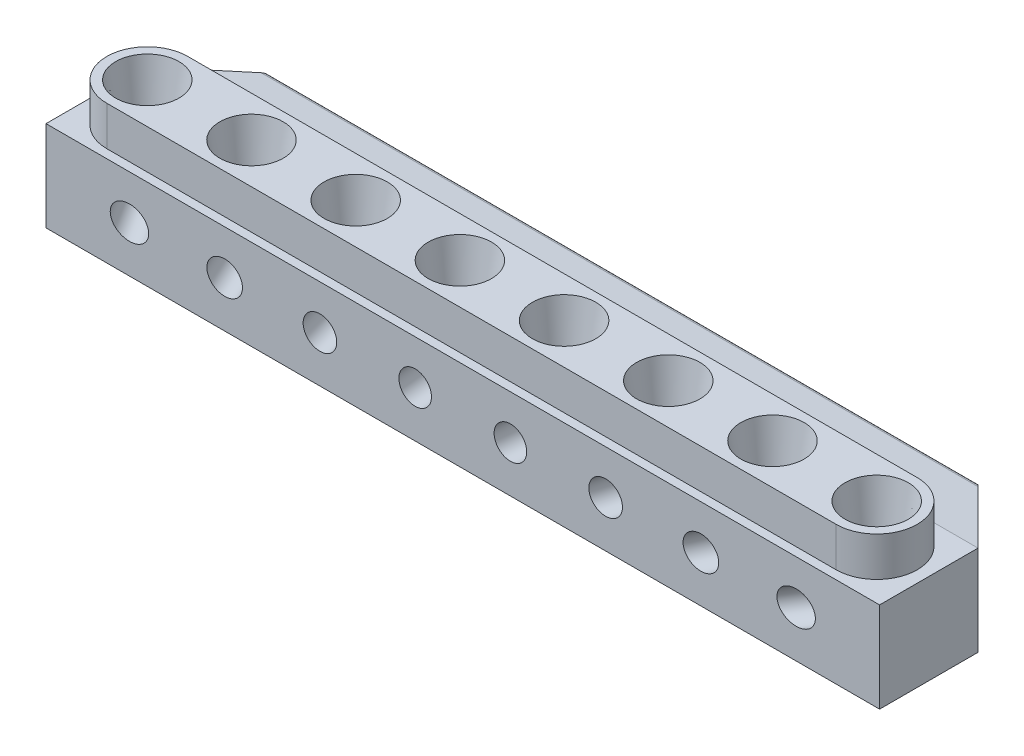
from build123d import *

# Parameters (mm, degrees)
SKETCH1_W           = 72
SKETCH1_H           = 8.5
BOSS_EXTRUDE1_DEPTH = 11.2
LPATTERN1_COUNT     = 8
LPATTERN1_PITCH     = 9
BOSS_EXTRUDE2_DEPTH = 72
SKETCH16_R          = 1.05
CUT_EXTRUDE9_DEPTH  = 9.7
CUT_EXTRUDE11_DEPTH = 17
SKETCH21_W          = 68.8
SKETCH21_H          = 2.9
CUT_EXTRUDE14_DEPTH = 0.7
SKETCH23_W          = 72
SKETCH23_H          = 8.5
CUT_EXTRUDE15_DEPTH = 3.4
CUT_EXTRUDE20_REACH = 71.58
SKETCH34_R          = 1.4
CUT_EXTRUDE21_REACH = 71.58
SKETCH35_R          = 1.4
CUT_EXTRUDE22_REACH = 71.58
SKETCH36_R          = 1.4
CUT_EXTRUDE25_REACH = 71.58
SKETCH38_R          = 1.4
SKETCH32_R          = 0.8
CUT_EXTRUDE26_DEPTH = 6


with BuildPart() as part:
    # Sketch1 → Boss-Extrude1 (new body)
    with BuildSketch(Plane(origin=(0, 0, 0), x_dir=(1, 0, 0), z_dir=(0, 1, 0))):
        Rectangle(SKETCH1_W, SKETCH1_H)
    extrude(amount=BOSS_EXTRUDE1_DEPTH)

    # Sketch2 → Cut-Revolve1 (revolve, cut)
    with BuildSketch(Plane.ZY.offset(31.5)):
        Polygon((-2.73460501, 11.2), (-1.010760134, 0), (-1, 0), (0, 0), (0, 11.2), align=None)
    cut_revolve1 = revolve(axis=Axis((-31.5, 0, 0), (0, 1, 0)), mode=Mode.SUBTRACT)

    # LPattern1: Cut-Revolve1 ×8
    with Locations(*[(i * LPATTERN1_PITCH, 0, 0) for i in range(1, LPATTERN1_COUNT)]):
        add(cut_revolve1, mode=Mode.SUBTRACT)

    # Sketch7 → Boss-Extrude2 (add)
    with BuildSketch(Plane.ZY.offset(36)):
        with BuildLine():
            Line((-4.25, 7.8), (-4.25, 6.1))
            Line((-4.25, 6.1), (-9.285819858, 6.540577149))
            ThreePointArc((-9.285819858, 6.540577149), (-9.66098678, 6.95), (-9.285819858, 7.359422851))
            Line((-9.285819858, 7.359422851), (-4.25, 7.8))
        make_face()
        with BuildLine():
            Line((-4.25, 3.1), (-4.25, 1.4))
            Line((-4.25, 1.4), (-9.285819858, 1.840577149))
            ThreePointArc((-9.285819858, 1.840577149), (-9.66098678, 2.25), (-9.285819858, 2.659422851))
            Line((-9.285819858, 2.659422851), (-4.25, 3.1))
        make_face()
    extrude(amount=-BOSS_EXTRUDE2_DEPTH)

    # Sketch16 → Cut-Extrude9 (cut)
    with BuildSketch(Plane.XZ):
        with Locations(Location((-18, 0, 0), (0, 0, 270))):
            Circle(SKETCH16_R)
        with Locations(Location((18, 0, 0), (0, 0, 90))):
            Circle(SKETCH16_R)
    extrude(amount=-CUT_EXTRUDE9_DEPTH, mode=Mode.SUBTRACT)

    # Sketch17 → Cut-Extrude11 (cut)
    with BuildSketch(Plane(origin=(0, 0, 0), x_dir=(1, 0, 0), z_dir=(0, 1, 0))):
        Polygon((-36, 4.25), (-37.938688342, 4.25), (-37.938688342, 10.603030139), (-29.504915654, 10.745084346), align=None)
        Polygon((29.504915654, 10.745084346), (36, 4.25), (37.938688342, 4.25), (37.938688342, 10.603030139), align=None)
    extrude(amount=CUT_EXTRUDE11_DEPTH, mode=Mode.SUBTRACT)

    # Sketch21 → Cut-Extrude14 (cut)
    with BuildSketch(Plane.XZ):
        Rectangle(SKETCH21_W, SKETCH21_H)
    extrude(amount=-CUT_EXTRUDE14_DEPTH, mode=Mode.SUBTRACT)

    # Sketch23 → Cut-Extrude15 (cut)
    with BuildSketch(Plane(origin=(0, 11.2, 0), x_dir=(1, 0, 0), z_dir=(0, 1, 0))):
        Rectangle(SKETCH23_W, SKETCH23_H)
        with BuildLine():
            Line((-31.5, 3.5), (31.5, 3.5))
            ThreePointArc((31.5, 3.5), (35, 0), (31.5, -3.5))
            Line((31.5, -3.5), (-31.5, -3.5))
            ThreePointArc((-31.5, -3.5), (-35, 0), (-31.5, 3.5))
        make_face(mode=Mode.SUBTRACT)
    extrude(amount=-CUT_EXTRUDE15_DEPTH, mode=Mode.SUBTRACT)

    # Sketch34 → Cut-Extrude20 (cut, up to next)
    with BuildSketch(Plane(origin=(0, 4, 49.445095679), x_dir=(-0.8433914458128852, 0, 0.5372996083468249), z_dir=(-0.5372996083468249, 0, -0.8433914458128852)), mode=Mode.PRIVATE) as cut_extrude20_sk1:
        with Locations(Location((0, 0, 0), (0, 0, 180))):
            Circle(SKETCH34_R)
    cut_extrude20_tool1 = extrude(cut_extrude20_sk1.sketch, amount=CUT_EXTRUDE20_REACH, mode=Mode.PRIVATE) & part.part
    cut_extrude20 = cut_extrude20_tool1.solids().sort_by_distance((0, 4, 49.445096))[0]
    add(cut_extrude20, mode=Mode.SUBTRACT)

    # Sketch35 → Cut-Extrude21 (cut, up to next)
    with BuildSketch(Plane(origin=(0, 4, 49.445095679), x_dir=(0.9101933348940082, 0, -0.4141836466044066), z_dir=(0.41418364660440654, 0, 0.9101933348940081)), mode=Mode.PRIVATE) as cut_extrude21_sk1:
        Circle(SKETCH35_R)
    cut_extrude21_tool1 = extrude(cut_extrude21_sk1.sketch, amount=-CUT_EXTRUDE21_REACH, mode=Mode.PRIVATE) & part.part
    cut_extrude21 = cut_extrude21_tool1.solids().sort_by_distance((0, 4, 49.445096))[0]
    add(cut_extrude21, mode=Mode.SUBTRACT)

    # Sketch36 → Cut-Extrude22 (cut, up to next)
    with BuildSketch(Plane(origin=(0, 4, 49.445095679), x_dir=(0.9646896228583056, 0, -0.26338931555683925), z_dir=(0.26338931555683925, 0, 0.9646896228583056)), mode=Mode.PRIVATE) as cut_extrude22_sk1:
        Circle(SKETCH36_R)
    cut_extrude22_tool1 = extrude(cut_extrude22_sk1.sketch, amount=-CUT_EXTRUDE22_REACH, mode=Mode.PRIVATE) & part.part
    cut_extrude22 = cut_extrude22_tool1.solids().sort_by_distance((0, 4, 49.445096))[0]
    add(cut_extrude22, mode=Mode.SUBTRACT)

    # Sketch38 → Cut-Extrude25 (cut, up to next)
    with BuildSketch(Plane(origin=(0, 4, 49.445095679), x_dir=(0.9958841372179063, 0, -0.09063545243306559), z_dir=(0.09063545243306559, 0, 0.9958841372179063)), mode=Mode.PRIVATE) as cut_extrude25_sk1:
        Circle(SKETCH38_R)
    cut_extrude25_tool1 = extrude(cut_extrude25_sk1.sketch, amount=-CUT_EXTRUDE25_REACH, mode=Mode.PRIVATE) & part.part
    cut_extrude25 = cut_extrude25_tool1.solids().sort_by_distance((0, 4, 49.445096))[0]
    add(cut_extrude25, mode=Mode.SUBTRACT)

    # Mirror2: Cut-Extrude20, Cut-Extrude21, Cut-Extrude22, Cut-Extrude25 across plane
    add(cut_extrude20.mirror(Plane(origin=(0, 0, 0), x_dir=(0, 0, 1), z_dir=(1, 0, 0))), mode=Mode.SUBTRACT)
    add(cut_extrude21.mirror(Plane(origin=(0, 0, 0), x_dir=(0, 0, 1), z_dir=(1, 0, 0))), mode=Mode.SUBTRACT)
    add(cut_extrude22.mirror(Plane(origin=(0, 0, 0), x_dir=(0, 0, 1), z_dir=(1, 0, 0))), mode=Mode.SUBTRACT)
    add(cut_extrude25.mirror(Plane(origin=(0, 0, 0), x_dir=(0, 0, 1), z_dir=(1, 0, 0))), mode=Mode.SUBTRACT)

    # Sketch32 → Cut-Extrude26 (cut)
    with BuildSketch(Plane.XZ.offset(-0.7)):
        with Locations(Location((9, 0, 0), (0, 0, 270))):
            Circle(SKETCH32_R)
    extrude(amount=-CUT_EXTRUDE26_DEPTH, mode=Mode.SUBTRACT)


solid = part.part
